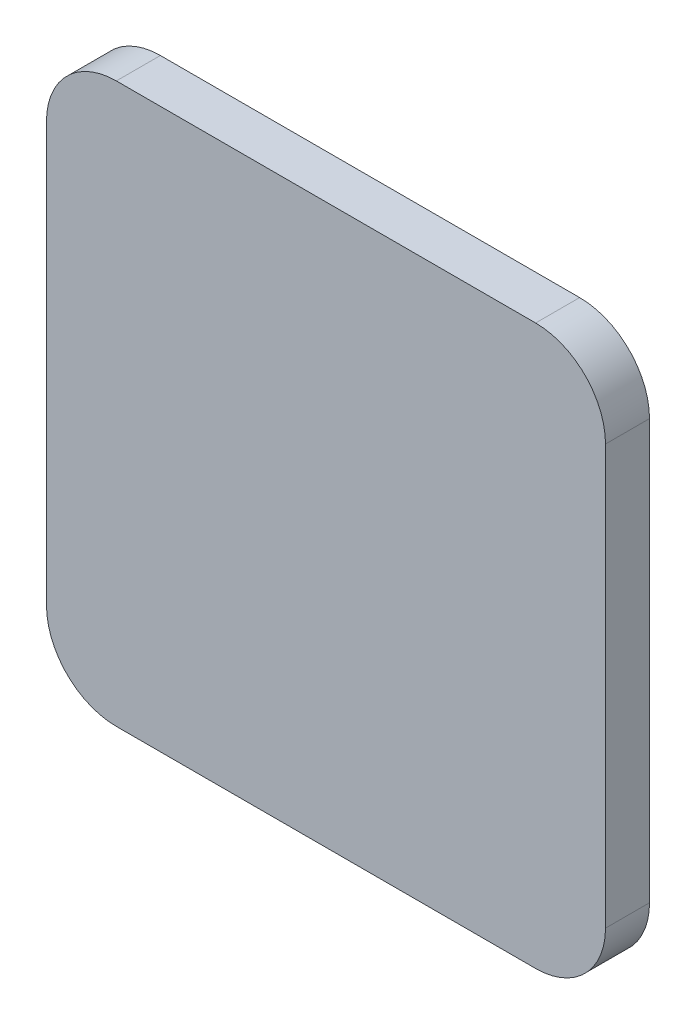
from build123d import *

# Parameters (mm, degrees)
BOSS_EXTRUDE1_DEPTH = 1.6


with BuildPart() as part:
    # Sketch2 → Boss-Extrude1 (new body)
    with BuildSketch(Plane.XY.offset(2.3)):
        with BuildLine():
            Line((-7.62, 10.16), (7.62, 10.16))
            ThreePointArc((7.62, 10.16), (9.416051224, 9.416051224), (10.16, 7.62))
            Line((10.16, 7.62), (10.16, -7.62))
            ThreePointArc((10.16, -7.62), (9.416051224, -9.416051224), (7.62, -10.16))
            Line((7.62, -10.16), (-7.62, -10.16))
            ThreePointArc((-7.62, -10.16), (-9.416051224, -9.416051224), (-10.16, -7.62))
            Line((-10.16, -7.62), (-10.16, 7.62))
            ThreePointArc((-10.16, 7.62), (-9.416051224, 9.416051224), (-7.62, 10.16))
        make_face()
    extrude(amount=BOSS_EXTRUDE1_DEPTH)


solid = part.part
